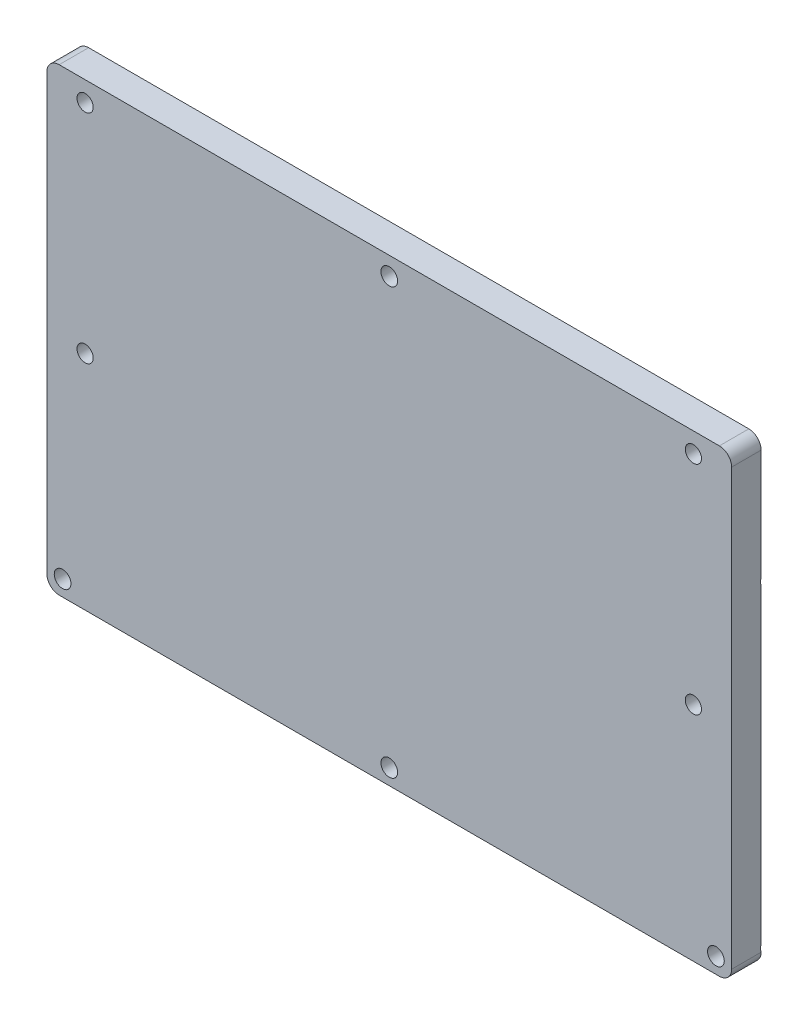
from build123d import *

# Parameters (mm, degrees)
BOSS_EXTRUDE1_DEPTH                               = 6
SKETCH8_W                                         = 4
SKETCH8_H                                         = 14
SKETCH9_W                                         = 4
SKETCH9_H                                         = 14
SKETCH10_W                                        = 4
SKETCH10_H                                        = 14
SKETCH11_W                                        = 4
SKETCH11_H                                        = 14
CSK_FOR_4_FLAT_HEAD_MACHINE_SCREW_100_D           = 3.4
CSK_FOR_4_FLAT_HEAD_MACHINE_SCREW_100_DEPTH       = 17
CSK_FOR_4_FLAT_HEAD_MACHINE_SCREW_100_CSINK_D     = 6.6
CSK_FOR_4_FLAT_HEAD_MACHINE_SCREW_100_CSINK_ANGLE = 88.289805
F_6_CLEARANCE_HOLE1_D                             = 4.2
F_6_CLEARANCE_HOLE1_DEPTH                         = 6
FILLET2_R                                         = 2.5
SKETCH19_W                                        = 1.65
SKETCH19_H                                        = 6.0002
M4X0_7_TAPPED_HOLE1_AT_2_COUNT                    = 2
M4X0_7_TAPPED_HOLE1_AT_2_PITCH                    = 44.196
M4X0_7_TAPPED_HOLE1_AT_3_COUNT                    = 2
M4X0_7_TAPPED_HOLE1_AT_3_PITCH                    = 131.475918103
M4X0_7_TAPPED_HOLE1_AT_4_COUNT                    = 2
M4X0_7_TAPPED_HOLE1_AT_4_PITCH                    = 123.825
SKETCH20_W                                        = 161.59397274
SKETCH20_H                                        = 68.078942219
CUT_EXTRUDE1_DEPTH                                = 120.401140756


with BuildPart() as part:
    # Sketch1 → Boss-Extrude1 (new body)
    with BuildSketch(Plane(origin=(0, 0, 0), x_dir=(-1, 0, 0), z_dir=(0, 0, -1))):
        with BuildLine():
            Line((-69.7, 93.82), (-69.7, 71.426225775))
            Line((-69.7, 71.426225775), (-69.7, 69.813774225))
            Line((-69.7, 69.813774225), (-69.7, 6.806225775))
            Line((-69.7, 6.806225775), (-69.7, 5.3))
            ThreePointArc((-69.7, 5.3), (-69.699314773, 5.241470835), (-69.69725947, 5.182973755))
            ThreePointArc((-69.69725947, 5.182973755), (-68.967766953, 3.532233047), (-67.317026245, 2.80274053))
            ThreePointArc((-67.317026245, 2.80274053), (-67.258529165, 2.800685227), (-67.2, 2.8))
            Line((-67.2, 2.8), (-65.693774225, 2.8))
            Line((-65.693774225, 2.8), (-0.806225775, 2.8))
            Line((-0.806225775, 2.8), (0.806225775, 2.8))
            Line((0.806225775, 2.8), (65.693774225, 2.8))
            Line((65.693774225, 2.8), (67.2, 2.8))
            ThreePointArc((67.2, 2.8), (67.258529165, 2.800685227), (67.317026245, 2.80274053))
            ThreePointArc((67.317026245, 2.80274053), (68.967766953, 3.532233047), (69.69725947, 5.182973755))
            ThreePointArc((69.69725947, 5.182973755), (69.699314773, 5.241470835), (69.7, 5.3))
            Line((69.7, 5.3), (69.7, 6.806225775))
            Line((69.7, 6.806225775), (69.7, 69.813774225))
            Line((69.7, 69.813774225), (69.7, 71.426225775))
            Line((69.7, 71.426225775), (69.7, 93.82))
            Line((69.7, 93.82), (69.7, 96.32))
            Line((69.7, 96.32), (67.2, 96.32))
            Line((67.2, 96.32), (-67.2, 96.32))
            Line((-67.2, 96.32), (-69.7, 96.32))
            Line((-69.7, 96.32), (-69.7, 93.82))
        make_face()
    extrude(amount=-BOSS_EXTRUDE1_DEPTH)

    # Sketch2 → Cut-Revolve1 (revolve, cut)
    with BuildSketch(Plane(origin=(0, 70.62, 0), x_dir=(1, 0, 0), z_dir=(0, 1, 0)), mode=Mode.PRIVATE) as cut_revolve1_sk:
        Polygon((69.800194118, 0.0002), (66.5, 0.0002), (66.5, -3), (68.2, -3), (68.2, -1.648484848), align=None)
    revolve(cut_revolve1_sk.sketch.rotate(Axis((66.5, 70.62, -0.0002), (0, 0, 1)), 14.141110809), axis=Axis((66.5, 70.62, -0.0002), (0, 0, 1)), mode=Mode.SUBTRACT)

    # Sketch3 → Cut-Revolve2 (revolve, cut)
    with BuildSketch(Plane(origin=(0, 70.62, 0), x_dir=(1, 0, 0), z_dir=(0, 1, 0)), mode=Mode.PRIVATE) as cut_revolve2_sk:
        Polygon((-63.199805882, 0.0002), (-66.5, 0.0002), (-66.5, -3), (-64.8, -3), (-64.8, -1.648484848), align=None)
    revolve(cut_revolve2_sk.sketch.rotate(Axis((-66.5, 70.62, -0.0002), (0, 0, 1)), 165.858889766), axis=Axis((-66.5, 70.62, -0.0002), (0, 0, 1)), mode=Mode.SUBTRACT)

    # Sketch8 → Revolve5 (revolve)
    with BuildSketch(Plane.XZ.offset(-92.256), mode=Mode.PRIVATE) as revolve5_sk:
        with Locations((63.91, 10)):
            Rectangle(SKETCH8_W, SKETCH8_H)
    revolve(revolve5_sk.sketch.rotate(Axis((61.91, 92.256, 17.005), (0, 0, -1)), 180), axis=Axis((61.91, 92.256, 17.005), (0, 0, -1)))

    # Sketch9 → Revolve6 (revolve)
    with BuildSketch(Plane.XZ.offset(-92.256), mode=Mode.PRIVATE) as revolve6_sk:
        with Locations((-59.915, 10)):
            Rectangle(SKETCH9_W, SKETCH9_H)
    revolve(revolve6_sk.sketch.rotate(Axis((-61.915, 92.256, 17.005), (0, 0, -1)), 180), axis=Axis((-61.915, 92.256, 17.005), (0, 0, -1)))

    # Sketch10 → Revolve7 (revolve)
    with BuildSketch(Plane.XZ.offset(-48.06), mode=Mode.PRIVATE) as revolve7_sk:
        with Locations((63.91, 10)):
            Rectangle(SKETCH10_W, SKETCH10_H)
    revolve(revolve7_sk.sketch.rotate(Axis((61.91, 48.06, 17.005), (0, 0, -1)), 180), axis=Axis((61.91, 48.06, 17.005), (0, 0, -1)))

    # Sketch11 → Revolve8 (revolve)
    with BuildSketch(Plane.XZ.offset(-48.06), mode=Mode.PRIVATE) as revolve8_sk:
        with Locations((-59.915, 10)):
            Rectangle(SKETCH11_W, SKETCH11_H)
    revolve(revolve8_sk.sketch.rotate(Axis((-61.915, 48.06, 17.005), (0, 0, -1)), 180), axis=Axis((-61.915, 48.06, 17.005), (0, 0, -1)))

    # CSK for #4 Flat Head Machine Screw (100)1
    with Locations(Plane(origin=(0, 0, 0), x_dir=(-1, 0, 0), z_dir=(0, 0, -1))):
        with Locations((66.5, 6), (0, 6), (-66.5, 6), (0, 92.62)):
            CounterSinkHole(CSK_FOR_4_FLAT_HEAD_MACHINE_SCREW_100_D / 2, CSK_FOR_4_FLAT_HEAD_MACHINE_SCREW_100_CSINK_D / 2, depth=CSK_FOR_4_FLAT_HEAD_MACHINE_SCREW_100_DEPTH, counter_sink_angle=CSK_FOR_4_FLAT_HEAD_MACHINE_SCREW_100_CSINK_ANGLE)

    # #6 Clearance Hole1
    with Locations(Plane.XY.offset(17)):
        with Locations((-61.915, 48.06), (61.91, 48.06), (-61.915, 92.256), (61.91, 92.256)):
            Hole(F_6_CLEARANCE_HOLE1_D / 2, depth=F_6_CLEARANCE_HOLE1_DEPTH)

    # Fillet2
    fillet2_edges = [part.edges().sort_by_distance(p)[0] for p in [
        (69.7, 96.32, 3),
        (-69.7, 96.32, 3),
    ]]
    fillet(fillet2_edges, radius=FILLET2_R)

    # Sketch19 → M4x0.7 Tapped Hole1 (revolve, cut)
    with BuildSketch(Plane(origin=(-61.915, 48.06, 6), x_dir=(0, -1, 0), z_dir=(1, 0, 0))):
        with Locations((0.825, 3.0001)):
            Rectangle(SKETCH19_W, SKETCH19_H)
    m4x0_7_tapped_hole1 = revolve(axis=Axis((-61.915, 48.06, 12.35), (0, 0, -1)), mode=Mode.SUBTRACT)

    # M4x0.7 Tapped Hole1 at 2: M4x0.7 Tapped Hole1 ×2
    with Locations(*[(0, i * M4X0_7_TAPPED_HOLE1_AT_2_PITCH, 0) for i in range(1, M4X0_7_TAPPED_HOLE1_AT_2_COUNT)]):
        add(m4x0_7_tapped_hole1, mode=Mode.SUBTRACT)

    # M4x0.7 Tapped Hole1 at 3: M4x0.7 Tapped Hole1 ×2
    with Locations(*[Vector(0.941807456351738, 0.3361528151901589, 0) * (i * M4X0_7_TAPPED_HOLE1_AT_3_PITCH) for i in range(1, M4X0_7_TAPPED_HOLE1_AT_3_COUNT)]):
        add(m4x0_7_tapped_hole1, mode=Mode.SUBTRACT)

    # M4x0.7 Tapped Hole1 at 4: M4x0.7 Tapped Hole1 ×2
    with Locations(*[(i * M4X0_7_TAPPED_HOLE1_AT_4_PITCH, 0, 0) for i in range(1, M4X0_7_TAPPED_HOLE1_AT_4_COUNT)]):
        add(m4x0_7_tapped_hole1, mode=Mode.SUBTRACT)

    # Sketch20 → Cut-Extrude1 (cut, through all)
    with BuildSketch(Plane.XY.offset(6)):
        with Locations((-0.997493659, 67.826602629)):
            Rectangle(SKETCH20_W, SKETCH20_H)
    extrude(amount=CUT_EXTRUDE1_DEPTH, mode=Mode.SUBTRACT)


solid = part.part
